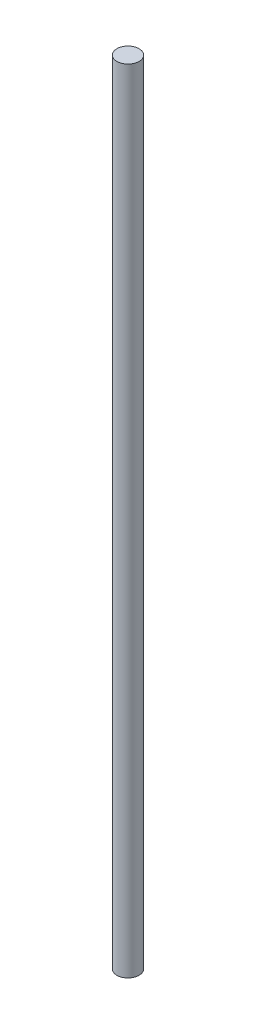
from build123d import *

# Parameters (mm, degrees)
CROQUIS1_R              = 3.5
SALIENTE_EXTRUIR1_DEPTH = 250


with BuildPart() as part:
    # Croquis1 → Saliente-Extruir1 (new body)
    with BuildSketch(Plane(origin=(0, 0, 0), x_dir=(1, 0, 0), z_dir=(0, 1, 0))):
        with Locations(Location((0, 0, 0), (0, 0, 270))):
            Circle(CROQUIS1_R)
    extrude(amount=SALIENTE_EXTRUIR1_DEPTH)


solid = part.part
